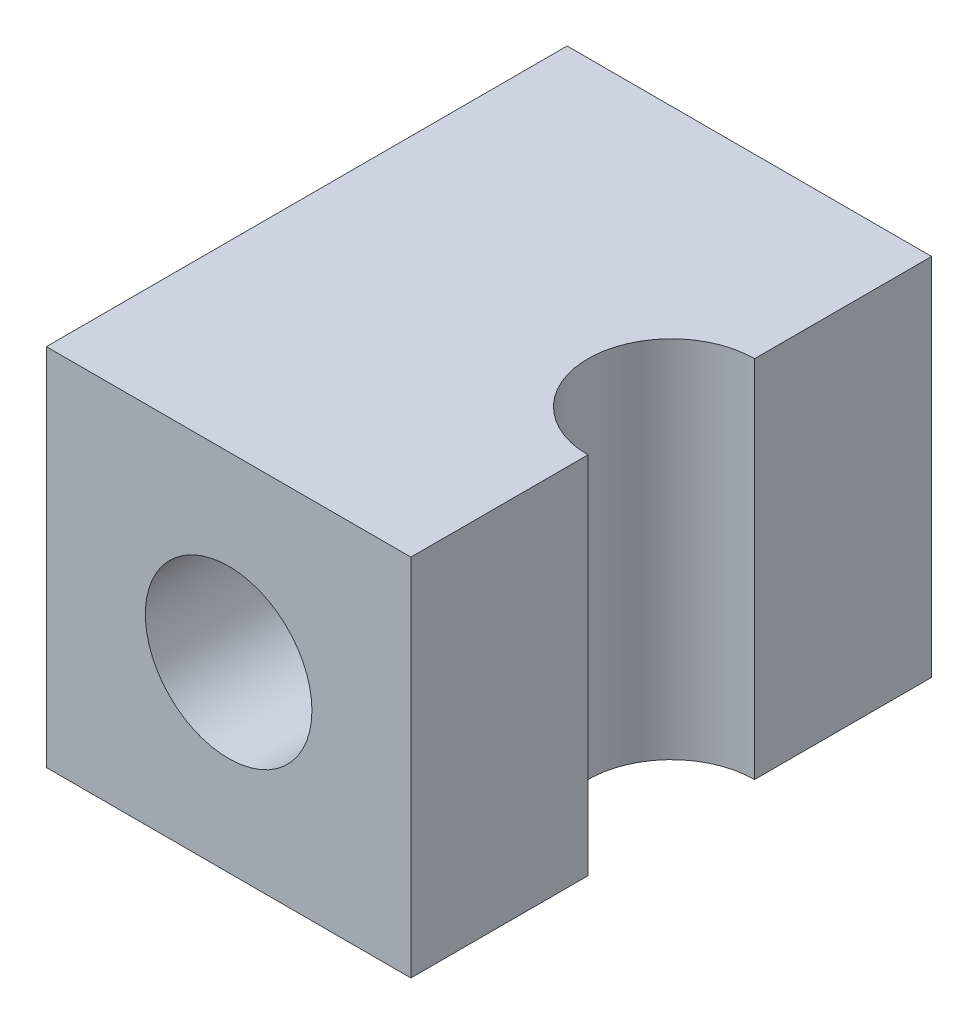
from build123d import *

# Parameters (mm, degrees)
SKETCH1_W           = 7
SKETCH1_H           = 7
SKETCH1_R           = 1.6
BOSS_EXTRUDE1_DEPTH = 5
SKETCH2_R           = 1.6
CUT_EXTRUDE1_DEPTH  = 10.287087811


with BuildPart() as part:
    # Sketch1 → Boss-Extrude1 (new, symmetric)
    with BuildSketch(Plane.XY):
        Rectangle(SKETCH1_W, SKETCH1_H)
        Circle(SKETCH1_R, mode=Mode.SUBTRACT)
    extrude(amount=BOSS_EXTRUDE1_DEPTH, both=True)

    # Sketch2 → Cut-Extrude1 (cut, through all)
    with BuildSketch(Plane(origin=(0, 3.5, 0), x_dir=(1, 0, 0), z_dir=(0, 1, 0))):
        with Locations((3.5, 0)):
            Circle(SKETCH2_R)
    extrude(amount=-CUT_EXTRUDE1_DEPTH, mode=Mode.SUBTRACT)


solid = part.part
